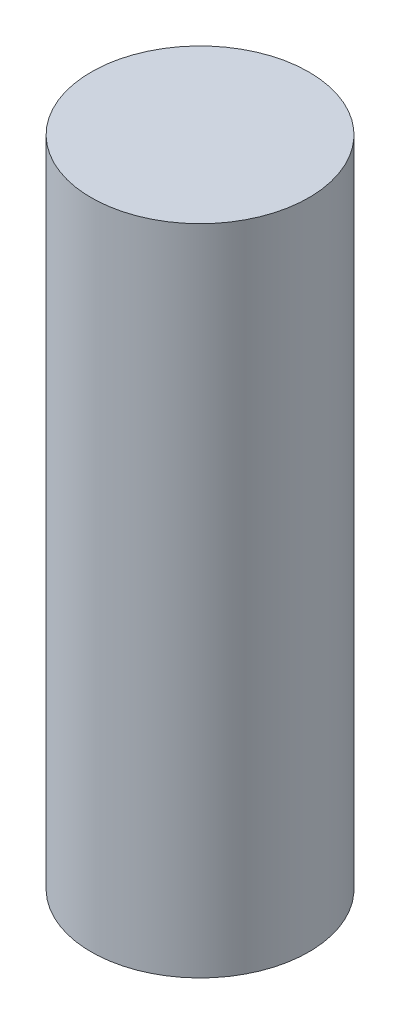
from build123d import *

# Parameters (mm, degrees)
SKETCH1_R           = 50.8
BOSS_EXTRUDE1_DEPTH = 304.8


with BuildPart() as part:
    # Sketch1 → Boss-Extrude1 (new body)
    with BuildSketch(Plane(origin=(0, 0, 0), x_dir=(1, 0, 0), z_dir=(0, 1, 0))):
        with Locations(Location((0, 0, 0), (0, 0, 90))):
            Circle(SKETCH1_R)
    extrude(amount=BOSS_EXTRUDE1_DEPTH)


solid = part.part
